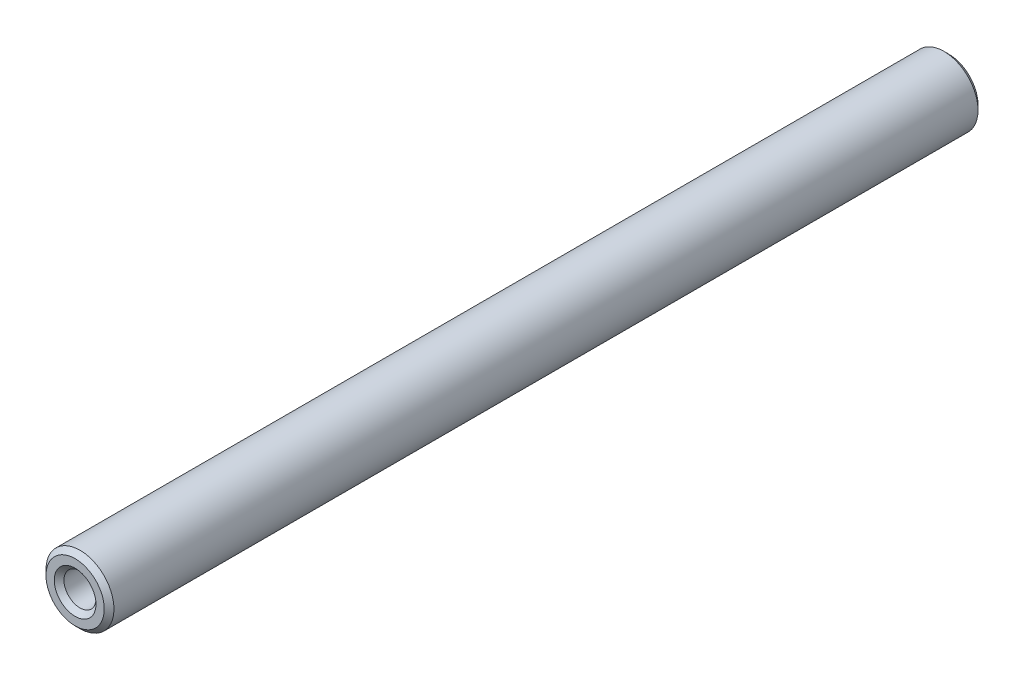
from build123d import *

# Parameters (mm, degrees)
SKETCH_1_R                       = 3.5
EXTRUDE_1_DEPTH                  = 45
HOLE_WIZARD_M4_1_D               = 3.3
HOLE_WIZARD_M4_1_DEPTH           = 12.1
HOLE_WIZARD_M4_1_TIP             = 0.991420021
HOLE_WIZARD_M4_1_ON_FACE_2_D     = 3.3
HOLE_WIZARD_M4_1_ON_FACE_2_DEPTH = 12.1
HOLE_WIZARD_M4_1_ON_FACE_2_TIP   = 0.991420021
CHAMFER_1_SIZE                   = 0.5


with BuildPart() as part:
    # 草图1 → 拉伸1 (new, symmetric)
    with BuildSketch(Plane.XY):
        with Locations(Location((0, 0, 0), (0, 0, 180))):
            Circle(SKETCH_1_R)
    extrude(amount=EXTRUDE_1_DEPTH, both=True)

    # M4 螺纹孔1
    with Locations(Plane.XY.offset(45)):
        with Locations((0, 0)):
            Hole(HOLE_WIZARD_M4_1_D / 2, depth=HOLE_WIZARD_M4_1_DEPTH)
            with Locations((0, 0, -(HOLE_WIZARD_M4_1_DEPTH + HOLE_WIZARD_M4_1_TIP / 2))):  # 118° drill point
                Cone(0, HOLE_WIZARD_M4_1_D / 2, HOLE_WIZARD_M4_1_TIP, mode=Mode.SUBTRACT)

    # M4 螺纹孔1 on face 2
    with Locations(Plane(origin=(0, 0, -45), x_dir=(-1, 0, 0), z_dir=(0, 0, -1))):
        with Locations((0, 0)):
            Hole(HOLE_WIZARD_M4_1_ON_FACE_2_D / 2, depth=HOLE_WIZARD_M4_1_ON_FACE_2_DEPTH)
            with Locations((0, 0, -(HOLE_WIZARD_M4_1_ON_FACE_2_DEPTH + HOLE_WIZARD_M4_1_ON_FACE_2_TIP / 2))):  # 118° drill point
                Cone(0, HOLE_WIZARD_M4_1_ON_FACE_2_D / 2, HOLE_WIZARD_M4_1_ON_FACE_2_TIP, mode=Mode.SUBTRACT)

    # 倒角1
    chamfer_1_edges = [part.edges().sort_by_distance(p)[0] for p in [
        (3.5, 0, -45),
        (3.5, 0, 45),
        (-1.65, 0, -45),
        (1.65, 0, 45),
    ]]
    chamfer(chamfer_1_edges, length=CHAMFER_1_SIZE)


solid = part.part
